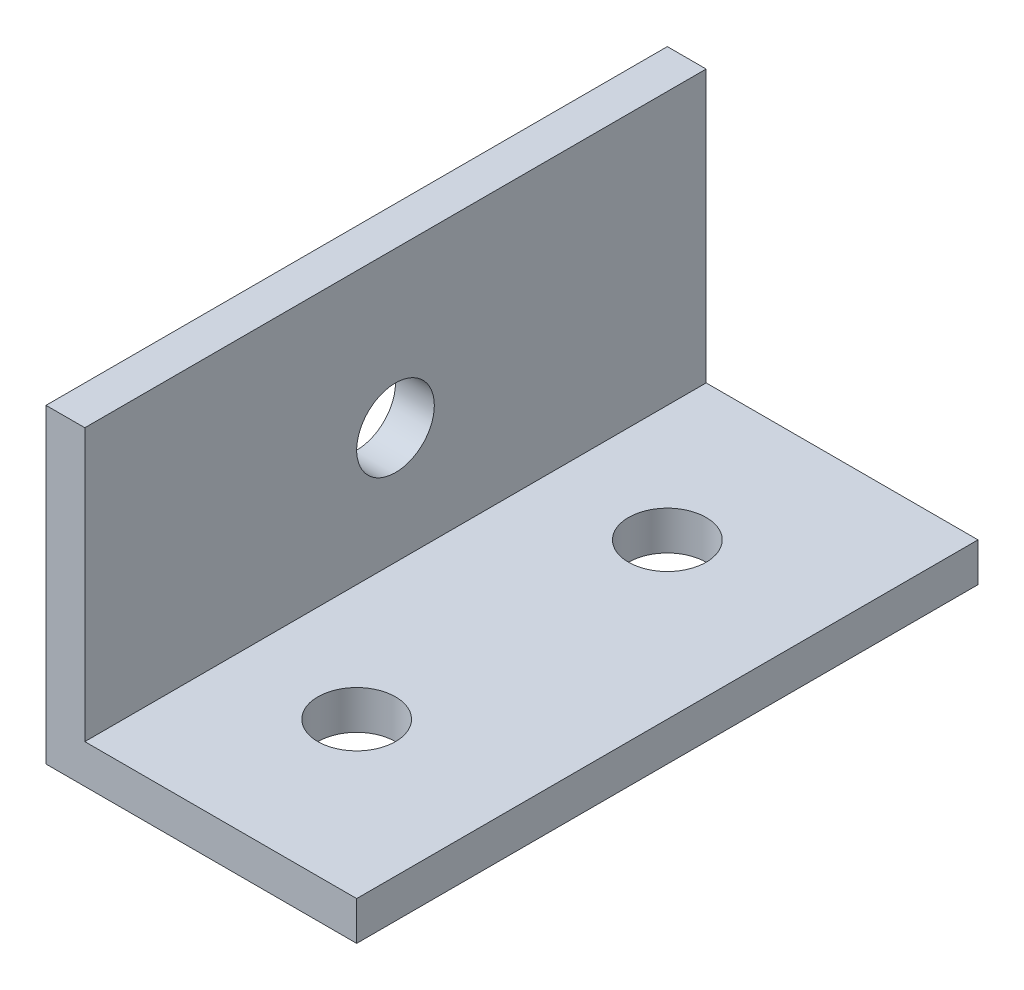
from build123d import *

# Parameters (mm, degrees)
BOSS_EXTRUDE1_DEPTH = 50.8
SKETCH2_R           = 3.175
CUT_EXTRUDE1_DEPTH  = 61.989758362
SKETCH3_R           = 3.175
CUT_EXTRUDE2_DEPTH  = 61.989758362


with BuildPart() as part:
    # Sketch1 → Boss-Extrude1 (new body)
    with BuildSketch(Plane.XY):
        Polygon((0, 0), (25.4, 0), (25.4, 3.175), (3.175, 3.175), (3.175, 25.4), (0, 25.4), align=None)
    extrude(amount=BOSS_EXTRUDE1_DEPTH)

    # Sketch2 → Cut-Extrude1 (cut, through all)
    with BuildSketch(Plane(origin=(3.175, 0, 0), x_dir=(0, 0, -1), z_dir=(1, 0, 0))):
        with Locations((-25.4, 12.7)):
            Circle(SKETCH2_R)
    extrude(amount=-CUT_EXTRUDE1_DEPTH, mode=Mode.SUBTRACT)

    # Sketch3 → Cut-Extrude2 (cut, through all)
    with BuildSketch(Plane(origin=(0, 3.175, 0), x_dir=(1, 0, 0), z_dir=(0, 1, 0))):
        with Locations(Location((12.7, -38.1, 0), (0, 0, 180))):
            Circle(SKETCH3_R)
        with Locations(Location((12.7, -12.7, 0), (0, 0, 180))):
            Circle(SKETCH3_R)
    extrude(amount=-CUT_EXTRUDE2_DEPTH, mode=Mode.SUBTRACT)


solid = part.part
